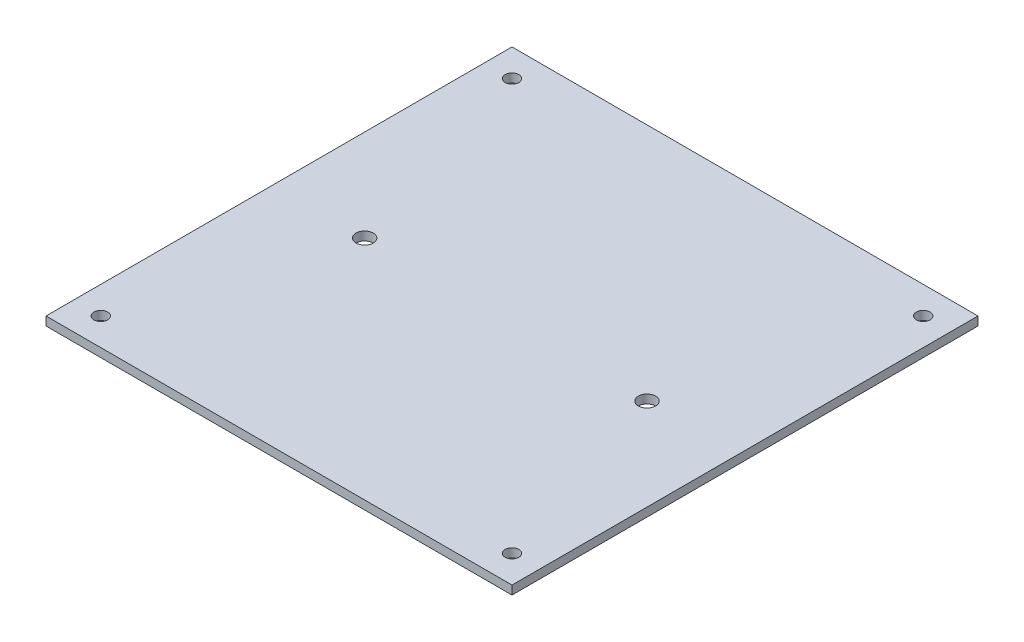
from build123d import *

# Parameters (mm, degrees)
SKETCH1_W           = 170
SKETCH1_H           = 170
SKETCH1_R           = 2.5
SKETCH1_W_2         = 117
SKETCH1_H_2         = 122.5
SKETCH1_R_2         = 3.15
BOSS_EXTRUDE1_DEPTH = 3.175


with BuildPart() as part:
    # Sketch1 → Boss-Extrude1 (new body)
    # profile 1 of 2: a face of its own
    with BuildSketch(Plane(origin=(0, 0, 0), x_dir=(1, 0, 0), z_dir=(0, 1, 0))):
        Rectangle(SKETCH1_W, SKETCH1_H)
        with Locations(Location((75, -75, 0), (0, 0, 270))):
            Circle(SKETCH1_R, mode=Mode.SUBTRACT)
        with Locations(Location((75, 75, 0), (0, 0, 270))):
            Circle(SKETCH1_R, mode=Mode.SUBTRACT)
        with Locations(Location((-75, 75, 0), (0, 0, 270))):
            Circle(SKETCH1_R, mode=Mode.SUBTRACT)
        with Locations(Location((-75, -75, 0), (0, 0, 270))):
            Circle(SKETCH1_R, mode=Mode.SUBTRACT)
        Rectangle(SKETCH1_W_2, SKETCH1_H_2, mode=Mode.SUBTRACT)
    # profile 2 of 2: a face of its own
    with BuildSketch(Plane(origin=(0, 0, 0), x_dir=(1, 0, 0), z_dir=(0, 1, 0))):
        Rectangle(SKETCH1_W_2, SKETCH1_H_2)
        with Locations(Location((51.5, -2.25, 0), (0, 0, 270))):
            Circle(SKETCH1_R_2, mode=Mode.SUBTRACT)
        with Locations(Location((-51.5, -2.25, 0), (0, 0, 270))):
            Circle(SKETCH1_R_2, mode=Mode.SUBTRACT)
    extrude(amount=BOSS_EXTRUDE1_DEPTH)


solid = part.part
